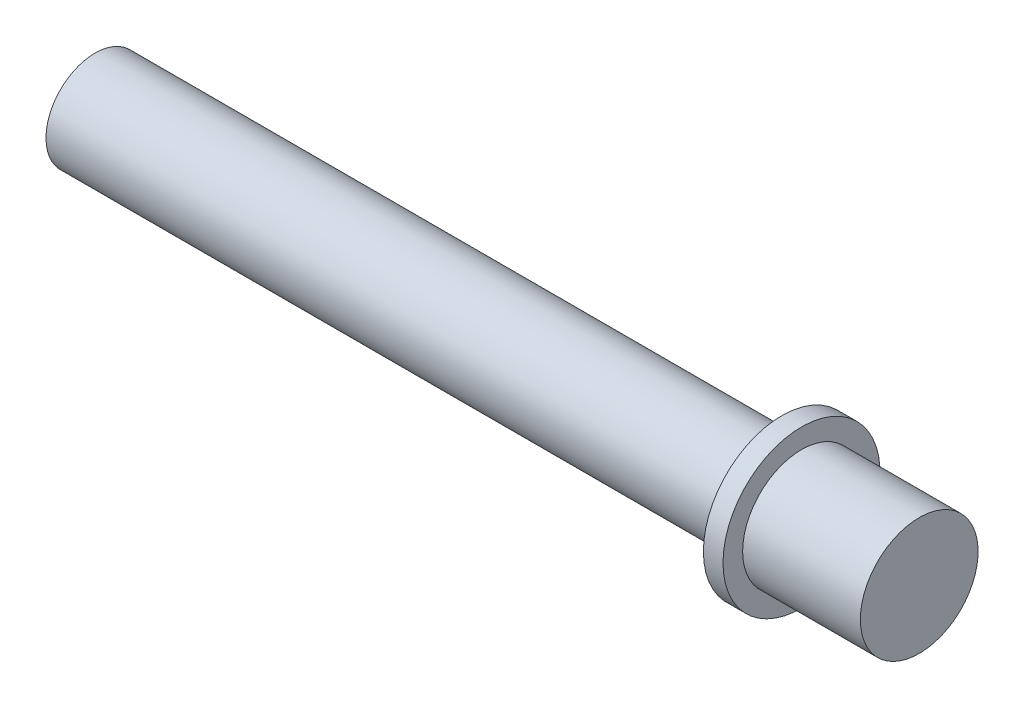
from build123d import *


with BuildPart() as part:
    # Sketch1 → Revolve1 (revolve)
    with BuildSketch(Plane.XY, mode=Mode.PRIVATE) as revolve1_sk:
        Polygon((0, 0), (0, 6), (-12, 6), (-12, 8), (-14, 8), (-14, 5), (-84, 5), (-84, 0), align=None)
    revolve(revolve1_sk.sketch.rotate(Axis((-84, 0, 0), (1, 0, 0)), 90), axis=Axis((-84, 0, 0), (1, 0, 0)))


solid = part.part
